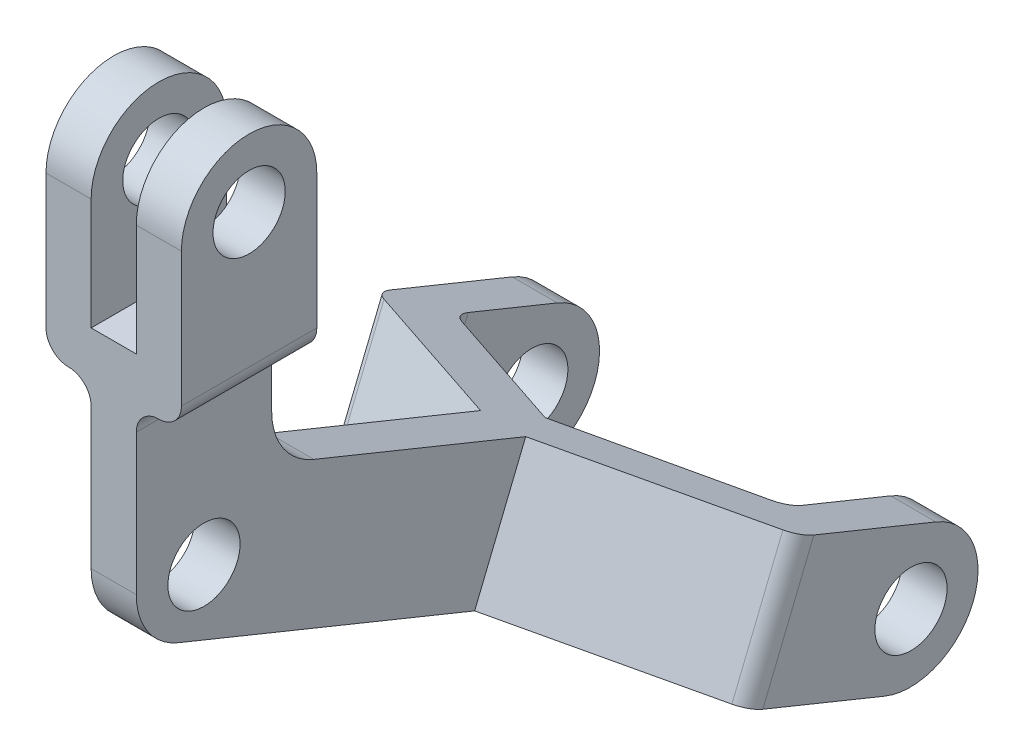
from build123d import *

# Parameters (mm, degrees)
SKETCH1_R           = 4
BOSS_EXTRUDE1_DEPTH = 5
BOSS_EXTRUDE2_DEPTH = 15
SKETCH3_R           = 7.5
SKETCH3_R_2         = 4
BOSS_EXTRUDE3_DEPTH = 5
SKETCH5_R           = 4
CUT_EXTRUDE1_DEPTH  = 5
BOSS_EXTRUDE4_START = -5
SKETCH6_R           = 7.5
BOSS_EXTRUDE4_DEPTH = 5
CUT_EXTRUDE2_START  = -5
SKETCH7_R           = 4
CUT_EXTRUDE2_DEPTH  = 5
BOSS_EXTRUDE5_DEPTH = 15
SKETCH9_R           = 7.5
BOSS_EXTRUDE6_DEPTH = 5
SKETCH10_R          = 7.5
BOSS_EXTRUDE7_DEPTH = 5
SKETCH11_R          = 4
CUT_EXTRUDE3_DEPTH  = 64
SCALE1_SCALE        = 0.7


with BuildPart() as part:
    # Sketch1 → Boss-Extrude1 (new body)
    with BuildSketch(Plane(origin=(0, 0, 0), x_dir=(0, 0, -1), z_dir=(1, 0, 0))):
        with BuildLine():
            Line((15, 0), (0, 0))
            Line((0, 0), (0, -15.59))
            ThreePointArc((0, -15.59), (1.276909506, -19.776065539), (4.672838586, -22.536737244))
            Line((4.672838586, -22.536737244), (37.484806943, -35.890449582))
            Line((37.484806943, -35.890449582), (43.13912977, -21.996975093))
            Line((43.13912977, -21.996975093), (19.672838586, -12.446737244))
            ThreePointArc((19.672838586, -12.446737244), (16.276909506, -9.686065539), (15, -5.5))
            Line((15, -5.5), (15, 0))
        make_face()
        with Locations((7.5, -16.462434129)):
            Circle(SKETCH1_R, mode=Mode.SUBTRACT)
    extrude(amount=BOSS_EXTRUDE1_DEPTH)

    # Sketch2 → Boss-Extrude2 (add)
    with BuildSketch(Plane.XY):
        with BuildLine():
            Line((0, 0), (5, 0))
            ThreePointArc((5, 0), (5.732233047, 1.767766953), (7.5, 2.5))
            ThreePointArc((7.5, 2.5), (9.267766953, 3.232233047), (10, 5))
            Line((10, 5), (10, 19.86))
            Line((10, 19.86), (5, 19.86))
            Line((5, 19.86), (5, 7.5))
            Line((5, 7.5), (0, 7.5))
            Line((0, 7.5), (0, 19.86))
            Line((0, 19.86), (-5, 19.86))
            Line((-5, 19.86), (-5, 5))
            ThreePointArc((-5, 5), (-4.267766953, 3.232233047), (-2.5, 2.5))
            ThreePointArc((-2.5, 2.5), (-0.732233047, 1.767766953), (0, 0))
        make_face()
    extrude(amount=-BOSS_EXTRUDE2_DEPTH)

    # Sketch3 → Boss-Extrude3 (add)
    with BuildSketch(Plane(origin=(10, 0, 0), x_dir=(0, 0, -1), z_dir=(1, 0, 0))):
        with Locations((7.5, 19.86)):
            Circle(SKETCH3_R)
        with Locations((7.5, 19.86)):
            Circle(SKETCH3_R_2, mode=Mode.SUBTRACT)
    extrude(amount=-BOSS_EXTRUDE3_DEPTH)

    # Sketch5 → Cut-Extrude1 (cut)
    with BuildSketch(Plane(origin=(10, 0, 0), x_dir=(0, 0, -1), z_dir=(1, 0, 0))):
        with Locations(Location((7.5, 19.86, 0), (0, 0, 90))):
            Circle(SKETCH5_R)
    extrude(amount=-CUT_EXTRUDE1_DEPTH, mode=Mode.SUBTRACT)

    # Sketch6 → Boss-Extrude4 (add)
    with BuildSketch(Plane.ZY.offset(5).offset(BOSS_EXTRUDE4_START)):
        with Locations((-7.5, 19.86)):
            Circle(SKETCH6_R)
    extrude(amount=BOSS_EXTRUDE4_DEPTH)

    # Sketch7 → Cut-Extrude2 (cut)
    with BuildSketch(Plane.ZY.offset(5).offset(CUT_EXTRUDE2_START)):
        with Locations(Location((-7.5, 19.86, 0), (0, 0, 90))):
            Circle(SKETCH7_R)
    extrude(amount=CUT_EXTRUDE2_DEPTH, mode=Mode.SUBTRACT)

    # Sketch8 → Boss-Extrude5 (add)
    with BuildSketch(Plane(origin=(0, -3.809395954, 1.55033606), x_dir=(1, 0, 0), z_dir=(0, 0.926231632569695, -0.376954855158118))):
        with BuildLine():
            Line((0, 48.248693155), (5, 48.248693155))
            Line((5, 48.248693155), (24.55634321, 57.895622609))
            ThreePointArc((24.55634321, 57.895622609), (25.552769913, 58.816883816), (25.92108759, 60.122996551))
            Line((25.92108759, 60.122996551), (25.92108759, 74.712996551))
            Line((25.92108759, 74.712996551), (20.92108759, 74.712996551))
            Line((20.92108759, 74.712996551), (20.92108759, 64.128787942))
            ThreePointArc((20.92108759, 64.128787942), (20.552769913, 62.822675208), (19.55634321, 61.901414001))
            Line((19.55634321, 61.901414001), (2.258260879, 53.528693155))
            Line((2.258260879, 53.528693155), (-14.685235236, 61.886733815))
            ThreePointArc((-14.685235236, 61.886733815), (-15.702336235, 62.808740922), (-16.079254544, 64.128787942))
            Line((-16.079254544, 64.128787942), (-16.079254544, 74.791257758))
            Line((-16.079254544, 74.791257758), (-21.079254544, 74.791257758))
            Line((-21.079254544, 74.791257758), (-21.079254544, 60.201257758))
            ThreePointArc((-21.079254544, 60.201257758), (-20.702336235, 58.881210738), (-19.685235236, 57.95920363))
            Line((-19.685235236, 57.95920363), (0, 48.248693155))
        make_face()
    extrude(amount=-BOSS_EXTRUDE5_DEPTH)

    # Sketch9 → Boss-Extrude6 (add)
    with BuildSketch(Plane(origin=(25.92108759, 0, 0), x_dir=(0, 0, -1), z_dir=(1, 0, 0))):
        with Locations((64.824043295, -38.919559991)):
            Circle(SKETCH9_R)
    extrude(amount=-BOSS_EXTRUDE6_DEPTH)

    # Sketch10 → Boss-Extrude7 (add)
    with BuildSketch(Plane.ZY.offset(21.079254544)):
        with Locations((-64.896531301, -38.949060933)):
            Circle(SKETCH10_R)
    extrude(amount=-BOSS_EXTRUDE7_DEPTH)

    # Sketch11 → Cut-Extrude3 (cut)
    with BuildSketch(Plane(origin=(25.92108759, 0, 0), x_dir=(0, 0, -1), z_dir=(1, 0, 0))):
        with Locations((64.896531301, -38.949060933)):
            Circle(SKETCH11_R)
    extrude(amount=-CUT_EXTRUDE3_DEPTH, mode=Mode.SUBTRACT)


with BuildPart() as part_1:
    # Scale1: scaled about (2.485117757, -17.850767572, -31.920196675)
    add(part.part.scale(SCALE1_SCALE).moved(Location((0.745535327, -5.355230272, -9.576059003))))


solid = part_1.part
